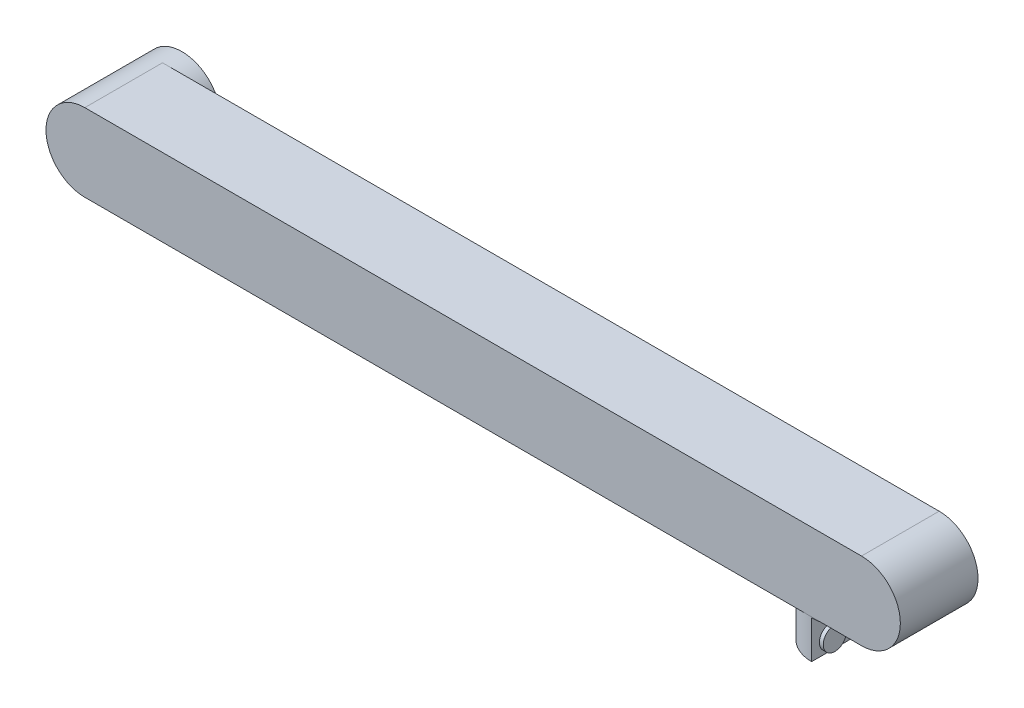
from build123d import *

# Parameters (mm, degrees)
BOSS_EXTRUDE1_DEPTH = 20
SKETCH4_R           = 10
BOSS_EXTRUDE3_DEPTH = 10
SKETCH5_W           = 23.907996497
SKETCH5_H           = 10.22824498
CUT_EXTRUDE2_DEPTH  = 50
BOSS_EXTRUDE4_START = 5
SKETCH7_R           = 10
BOSS_EXTRUDE4_DEPTH = 5
SKETCH11_R          = 3
BOSS_EXTRUDE7_DEPTH = 1


with BuildPart() as part:
    # Sketch2 → Boss-Extrude1 (new body)
    with BuildSketch(Plane.XY):
        with BuildLine():
            Line((-70.139472481, 19.207806068), (129.860527519, 19.207806068))
            ThreePointArc((129.860527519, 19.207806068), (136.931595331, 16.27887388), (139.860527519, 9.207806068))
            ThreePointArc((139.860527519, 9.207806068), (136.931595331, 2.136738256), (129.860527519, -0.792193932))
            Line((129.860527519, -0.792193932), (-70.139472481, -0.792193932))
            ThreePointArc((-70.139472481, -0.792193932), (-77.210540292, 2.136738256), (-80.139472481, 9.207806068))
            ThreePointArc((-80.139472481, 9.207806068), (-77.210540292, 16.27887388), (-70.139472481, 19.207806068))
        make_face()
    extrude(amount=BOSS_EXTRUDE1_DEPTH)

    # Sketch4 → Boss-Extrude3 (add)
    with BuildSketch(Plane.XZ.offset(0.792193932)):
        with Locations(Location((117.087248421, 10, 0), (0, 0, 270))):
            Circle(SKETCH4_R)
    extrude(amount=BOSS_EXTRUDE3_DEPTH)

    # Sketch5 → Cut-Extrude2 (cut)
    with BuildSketch(Plane(origin=(117, 0, 0), x_dir=(0, 0, -1), z_dir=(1, 0, 0))):
        with Locations((-10.311239758, -6.104621998)):
            Rectangle(SKETCH5_W, SKETCH5_H)
    extrude(amount=CUT_EXTRUDE2_DEPTH, mode=Mode.SUBTRACT)

    # Sketch7 → Boss-Extrude4 (add)
    with BuildSketch(Plane(origin=(0, 0, 0), x_dir=(-1, 0, 0), z_dir=(0, 0, -1)).offset(BOSS_EXTRUDE4_START)):
        with Locations((70.139472481, 9.207806068)):
            Circle(SKETCH7_R)
    extrude(amount=-BOSS_EXTRUDE4_DEPTH)

    # Sketch11 → Boss-Extrude7 (add)
    with BuildSketch(Plane(origin=(117, 0, 0), x_dir=(0, 0, -1), z_dir=(1, 0, 0))):
        with Locations((-14.992294677, -7.514688693)):
            Circle(SKETCH11_R)
        with Locations((-5, -7.514688693)):
            Circle(SKETCH11_R)
    extrude(amount=BOSS_EXTRUDE7_DEPTH)


solid = part.part
